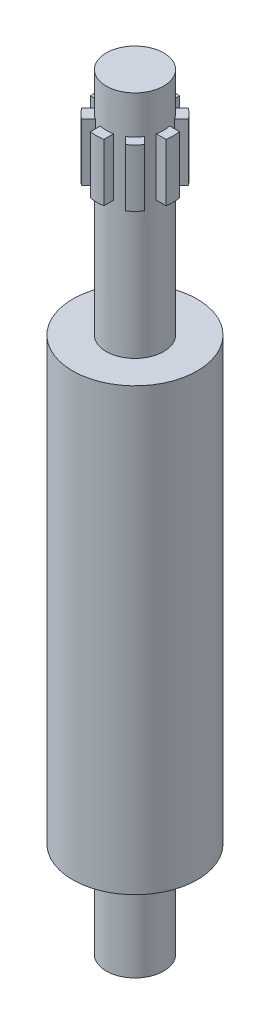
from build123d import *

# Parameters (mm, degrees)
SKETCH1_R           = 32.5
BOSS_EXTRUDE1_DEPTH = 230
SKETCH2_R           = 15
BOSS_EXTRUDE2_DEPTH = 100
BOSS_EXTRUDE3_START = 50
SKETCH3_R           = 15
BOSS_EXTRUDE3_DEPTH = 50
BOSS_EXTRUDE4_START = -30
BOSS_EXTRUDE4_DEPTH = 30
SKETCH5_R           = 15
BOSS_EXTRUDE5_DEPTH = 20


with BuildPart() as part:
    # Sketch1 → Boss-Extrude1 (new body)
    with BuildSketch(Plane(origin=(0, 0, 0), x_dir=(1, 0, 0), z_dir=(0, 1, 0))):
        with Locations(Location((0, 0, 0), (0, 0, 270))):
            Circle(SKETCH1_R)
    extrude(amount=BOSS_EXTRUDE1_DEPTH)

    # Sketch2 → Boss-Extrude2 (add)
    with BuildSketch(Plane(origin=(0, 230, 0), x_dir=(1, 0, 0), z_dir=(0, 1, 0))):
        with Locations(Location((0, 0, 0), (0, 0, 270))):
            Circle(SKETCH2_R)
    extrude(amount=BOSS_EXTRUDE2_DEPTH)

    # Sketch3 → Boss-Extrude3 (add)
    with BuildSketch(Plane.XZ.offset(BOSS_EXTRUDE3_START)):
        with Locations(Location((0, 0, 0), (0, 0, 90))):
            Circle(SKETCH3_R)
    extrude(amount=-BOSS_EXTRUDE3_DEPTH)

    # Sketch4 → Boss-Extrude4 (add)
    with BuildSketch(Plane(origin=(0, 330, 0), x_dir=(1, 0, 0), z_dir=(0, 1, 0)).offset(BOSS_EXTRUDE4_START)):
        with BuildLine():
            Line((-3.5, 19.691368668), (-3.5, 14.585952146))
            ThreePointArc((-3.5, 14.585952146), (-5.740251485, 13.858192988), (-7.838951938, 12.788699407))
            Line((-7.838951938, 12.788699407), (-11.449026581, 16.39877405))
            ThreePointArc((-11.449026581, 16.39877405), (-14.142135624, 14.142135624), (-16.39877405, 11.449026581))
            Line((-16.39877405, 11.449026581), (-12.788699407, 7.838951938))
            ThreePointArc((-12.788699407, 7.838951938), (-13.858192988, 5.740251485), (-14.585952146, 3.5))
            Line((-14.585952146, 3.5), (-19.691368668, 3.5))
            ThreePointArc((-19.691368668, 3.5), (-20, 0), (-19.691368668, -3.5))
            Line((-19.691368668, -3.5), (-14.585952146, -3.5))
            ThreePointArc((-14.585952146, -3.5), (-13.858192988, -5.740251485), (-12.788699407, -7.838951938))
            Line((-12.788699407, -7.838951938), (-16.39877405, -11.449026581))
            ThreePointArc((-16.39877405, -11.449026581), (-14.142135624, -14.142135624), (-11.449026581, -16.39877405))
            Line((-11.449026581, -16.39877405), (-7.838951938, -12.788699407))
            ThreePointArc((-7.838951938, -12.788699407), (-5.740251485, -13.858192988), (-3.5, -14.585952146))
            Line((-3.5, -14.585952146), (-3.5, -19.691368668))
            ThreePointArc((-3.5, -19.691368668), (0, -20), (3.5, -19.691368668))
            Line((3.5, -19.691368668), (3.5, -14.585952146))
            ThreePointArc((3.5, -14.585952146), (5.740251485, -13.858192988), (7.838951938, -12.788699407))
            Line((7.838951938, -12.788699407), (11.449026581, -16.39877405))
            ThreePointArc((11.449026581, -16.39877405), (14.142135624, -14.142135624), (16.39877405, -11.449026581))
            Line((16.39877405, -11.449026581), (12.788699407, -7.838951938))
            ThreePointArc((12.788699407, -7.838951938), (13.858192988, -5.740251485), (14.585952146, -3.5))
            Line((14.585952146, -3.5), (19.691368668, -3.5))
            ThreePointArc((19.691368668, -3.5), (20, 0), (19.691368668, 3.5))
            Line((19.691368668, 3.5), (14.585952146, 3.5))
            ThreePointArc((14.585952146, 3.5), (13.858192988, 5.740251485), (12.788699407, 7.838951938))
            Line((12.788699407, 7.838951938), (16.39877405, 11.449026581))
            ThreePointArc((16.39877405, 11.449026581), (14.142135624, 14.142135624), (11.449026581, 16.39877405))
            Line((11.449026581, 16.39877405), (7.838951938, 12.788699407))
            ThreePointArc((7.838951938, 12.788699407), (5.740251485, 13.858192988), (3.5, 14.585952146))
            Line((3.5, 14.585952146), (3.5, 19.691368668))
            ThreePointArc((3.5, 19.691368668), (0, 20), (-3.5, 19.691368668))
        make_face()
    extrude(amount=BOSS_EXTRUDE4_DEPTH)

    # Sketch5 → Boss-Extrude5 (add)
    with BuildSketch(Plane(origin=(0, 330, 0), x_dir=(1, 0, 0), z_dir=(0, 1, 0))):
        with Locations(Location((0, 0, 0), (0, 0, 270))):
            Circle(SKETCH5_R)
    extrude(amount=BOSS_EXTRUDE5_DEPTH)


solid = part.part
